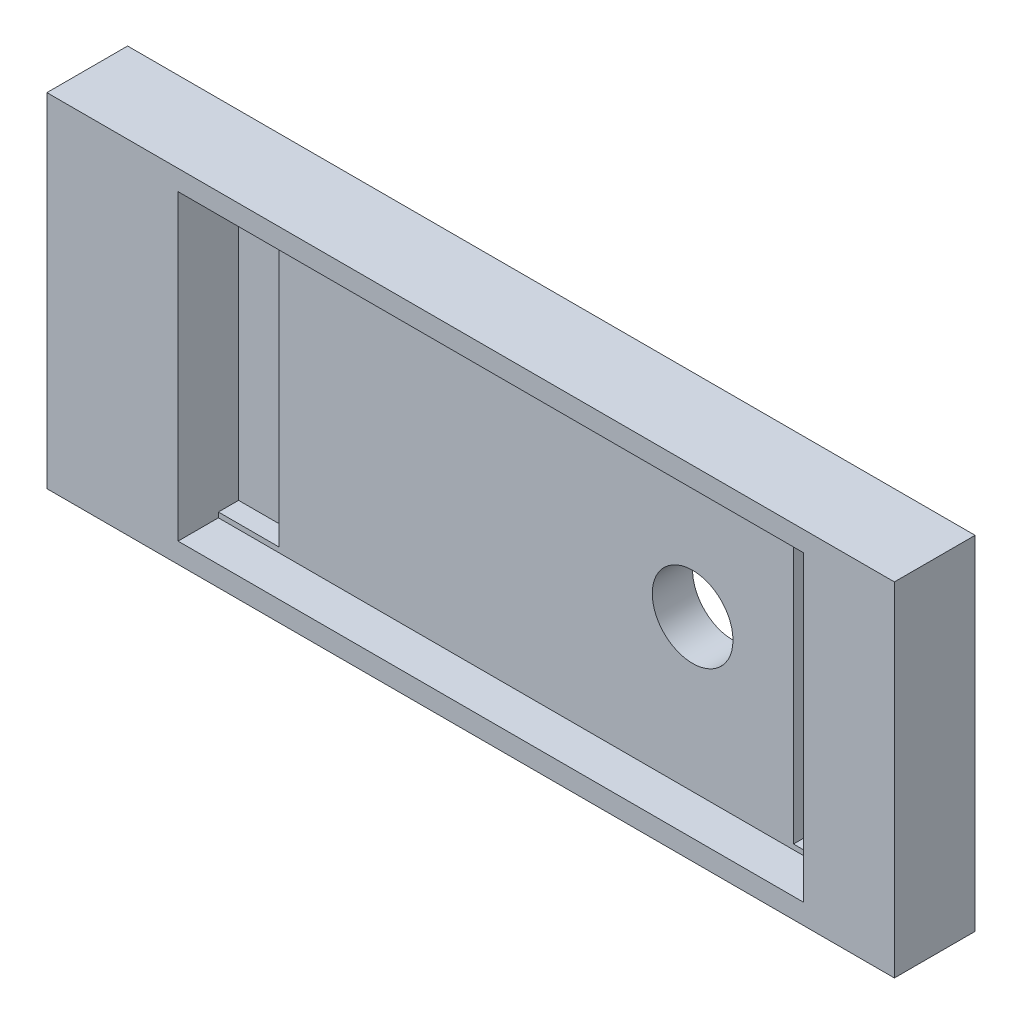
from build123d import *

# Parameters (mm, degrees)
SKETCH_1_R          = 2
EXTRUDE_1_DEPTH     = 2
SKETCH_3_W          = 3
SKETCH_3_H          = 14.5
CUT_EXTRUDE_1_DEPTH = 1
SKETCH_4_W          = 42
SKETCH_4_H          = 17
SKETCH_4_W_2        = 40
SKETCH_4_H_2        = 15
EXTRUDE_2_DEPTH     = 1
SKETCH_6_W          = 5.5
SKETCH_6_H          = 15
SKETCH_6_W_2        = 3.5
EXTRUDE_4_DEPTH     = 1
SKETCH_7_W          = 42
SKETCH_7_H          = 17
SKETCH_7_W_2        = 31
SKETCH_7_H_2        = 15
EXTRUDE_5_DEPTH     = 1


with BuildPart() as part:
    # 草图1 → 凸台-拉伸1 (new body)
    with BuildSketch(Plane.XY):
        Polygon((-30, 8.5), (-30, -8.5), (12, -8.5), (12, 0), (12, 8.5), align=None)
        Circle(SKETCH_1_R, mode=Mode.SUBTRACT)
    extrude(amount=EXTRUDE_1_DEPTH)

    # 草图3 → 切除-拉伸1 (cut)
    with BuildSketch(Plane.XY.offset(2)):
        with Locations((-22, 0)):
            Rectangle(SKETCH_3_W, SKETCH_3_H)
        Polygon((7.5, 7.25), (5, 7.25), (5, -7.25), (7.5, -7.25), (7.5, 0), align=None)
    extrude(amount=-CUT_EXTRUDE_1_DEPTH, mode=Mode.SUBTRACT)

    # 草图4 → 凸台-拉伸2 (add)
    with BuildSketch(Plane.XY.offset(2)):
        with Locations((-9, 0)):
            Rectangle(SKETCH_4_W, SKETCH_4_H)
        with Locations((-9, 0)):
            Rectangle(SKETCH_4_W_2, SKETCH_4_H_2, mode=Mode.SUBTRACT)
    extrude(amount=EXTRUDE_2_DEPTH)

    # 草图6 → 凸台-拉伸4 (add)
    with BuildSketch(Plane.XY.offset(2)):
        with Locations((-26.25, 0)):
            Rectangle(SKETCH_6_W, SKETCH_6_H)
        with Locations((9.25, 0)):
            Rectangle(SKETCH_6_W_2, SKETCH_6_H)
    extrude(amount=EXTRUDE_4_DEPTH)

    # 草图7 → 凸台-拉伸5 (add)
    with BuildSketch(Plane.XY.offset(3)):
        with Locations((-9, 0)):
            Rectangle(SKETCH_7_W, SKETCH_7_H)
        with Locations((-8, 0)):
            Rectangle(SKETCH_7_W_2, SKETCH_7_H_2, mode=Mode.SUBTRACT)
    extrude(amount=EXTRUDE_5_DEPTH)


solid = part.part
